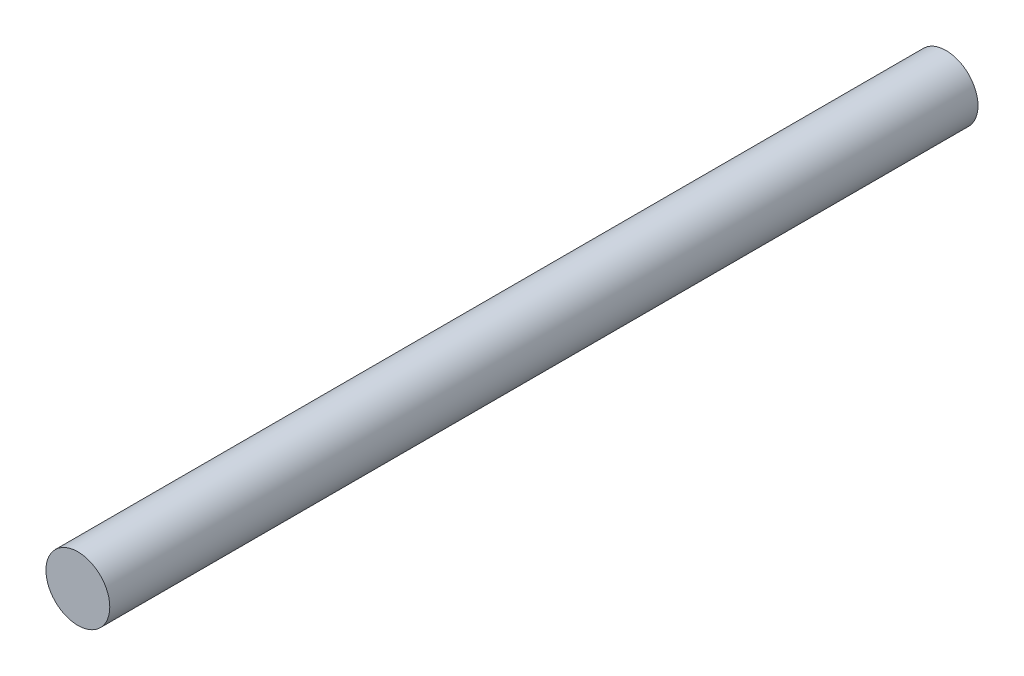
from build123d import *

# Parameters (mm, degrees)
SKETCH_1_R                                   = 2.5
PURCHASED_STEEL_SHAFT_D5_L68_NOT_PRINT_DEPTH = 68


with BuildPart() as part:
    # 草图1 → Purchased_steel_shaft_D5_L68_NOT_PRINT (new body)
    with BuildSketch(Plane.XY):
        Circle(SKETCH_1_R)
    extrude(amount=PURCHASED_STEEL_SHAFT_D5_L68_NOT_PRINT_DEPTH)


solid = part.part
